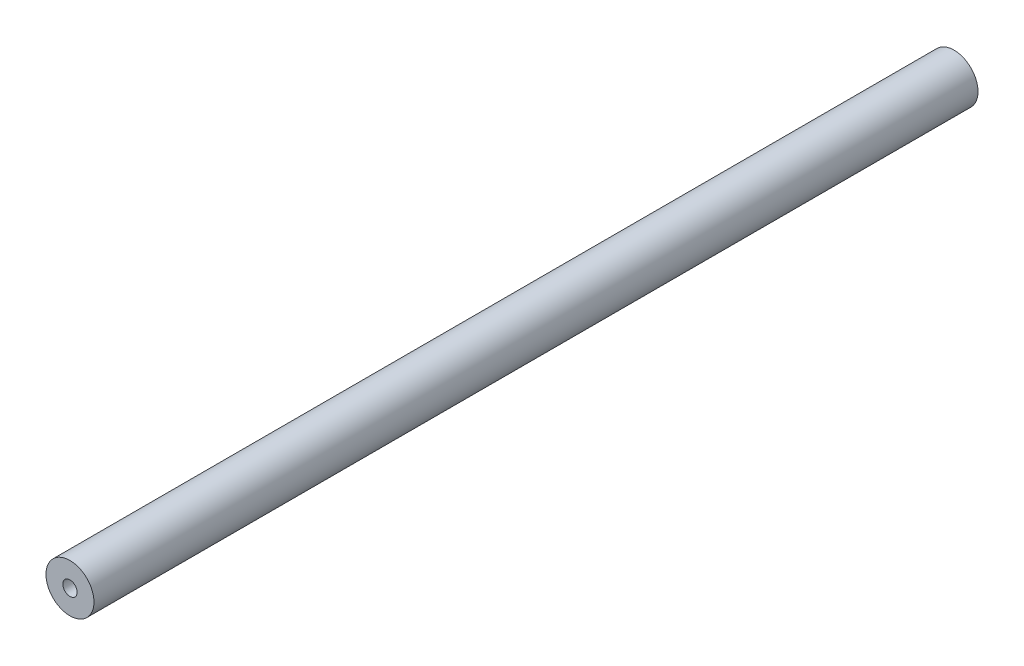
from build123d import *

# Parameters (mm, degrees)
SKETCH1_R                  = 6.35
BOSS_EXTRUDE1_DEPTH        = 233.9
F_10_24_TAPPED_HOLE1_D     = 3.7973
F_10_24_TAPPED_HOLE1_DEPTH = 12.83
F_10_24_TAPPED_HOLE1_TIP   = 1.140824014
F_10_24_TAPPED_HOLE2_D     = 3.7973
F_10_24_TAPPED_HOLE2_DEPTH = 12.83
F_10_24_TAPPED_HOLE2_TIP   = 1.140824014


with BuildPart() as part:
    # Sketch1 → Boss-Extrude1 (new body)
    with BuildSketch(Plane.XY):
        with Locations((110, 84.05)):
            Circle(SKETCH1_R)
    extrude(amount=-BOSS_EXTRUDE1_DEPTH)

    # #10-24 Tapped Hole1
    with Locations(Plane.XY):
        with Locations((110, 84.05)):
            Hole(F_10_24_TAPPED_HOLE1_D / 2, depth=F_10_24_TAPPED_HOLE1_DEPTH)
            with Locations((0, 0, -(F_10_24_TAPPED_HOLE1_DEPTH + F_10_24_TAPPED_HOLE1_TIP / 2))):  # 118° drill point
                Cone(0, F_10_24_TAPPED_HOLE1_D / 2, F_10_24_TAPPED_HOLE1_TIP, mode=Mode.SUBTRACT)

    # #10-24 Tapped Hole2
    with Locations(Plane(origin=(0, 0, -233.9), x_dir=(-1, 0, 0), z_dir=(0, 0, -1))):
        with Locations((-110, 84.05)):
            Hole(F_10_24_TAPPED_HOLE2_D / 2, depth=F_10_24_TAPPED_HOLE2_DEPTH)
            with Locations((0, 0, -(F_10_24_TAPPED_HOLE2_DEPTH + F_10_24_TAPPED_HOLE2_TIP / 2))):  # 118° drill point
                Cone(0, F_10_24_TAPPED_HOLE2_D / 2, F_10_24_TAPPED_HOLE2_TIP, mode=Mode.SUBTRACT)


solid = part.part
